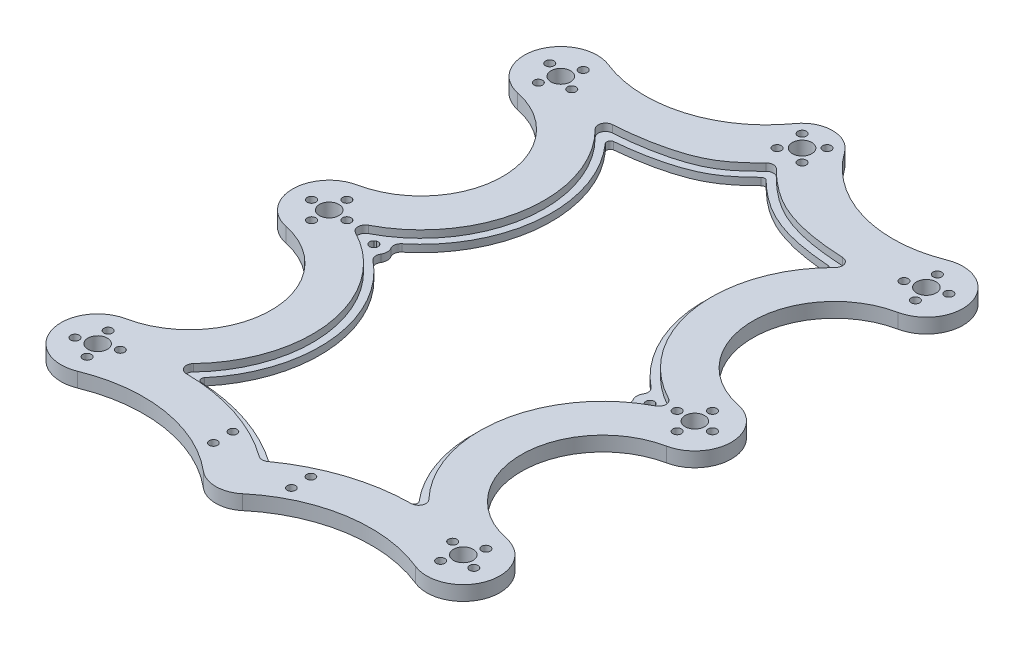
from build123d import *

# Parameters (mm, degrees)
BOSS_EXTRUDE1_DEPTH = 6
SKETCH2_R           = 4
CUT_EXTRUDE1_DEPTH  = 235.538376391
CUT_EXTRUDE2_REACH  = 236.538
SKETCH3_R           = 1.7
SKETCH4_R           = 3
CUT_EXTRUDE3_DEPTH  = 3
CUT_EXTRUDE4_REACH  = 236.481
CUT_EXTRUDE5_REACH  = 236.538
SKETCH6_R           = 1.75
CUT_EXTRUDE6_REACH  = 236.538
SKETCH8_R           = 1.75
BOSS_EXTRUDE2_START = -3.014
SKETCH9_R           = 4
SKETCH9_R_2         = 1.75
BOSS_EXTRUDE2_DEPTH = 3.014
FILLET1_R           = 3


with BuildPart() as part:
    # Sketch1 → Boss-Extrude1 (new body)
    with BuildSketch(Plane(origin=(0, 0, 0), x_dir=(1, 0, 0), z_dir=(0, 1, 0))):
        with BuildLine():
            ThreePointArc((-69.425886336, 13.925848515), (-89.364705834, 4.31916963), (-78.030296498, -14.690721668))
            ThreePointArc((-78.030296498, -14.690721668), (-51.297958971, -47.499999875), (-78.030296252, -80.309278281))
            ThreePointArc((-78.030296252, -80.309278281), (-90, -94.999999814), (-78.030296616, -109.690721644))
            ThreePointArc((-78.030296616, -109.690721644), (-51.297958971, -142.5), (-78.030296616, -175.309278356))
            ThreePointArc((-78.030296616, -175.309278356), (-89.351304792, -194.363490663), (-69.340019232, -203.891170494))
            ThreePointArc((-69.340019232, -203.891170494), (-37.34886135, -200.189043247), (-8.051740928, -213.561352835))
            ThreePointArc((-8.051740928, -213.561352835), (-6.73e-07, -216.5), (8.051739898, -213.561353702))
            ThreePointArc((8.051739898, -213.561353702), (37.348860289, -200.189043415), (69.340018489, -203.891170192))
            ThreePointArc((69.340018489, -203.891170192), (89.351304588, -194.363491335), (78.030297206, -175.309278478))
            ThreePointArc((78.030297206, -175.309278478), (51.297958971, -142.500000301), (78.030296616, -109.690721644))
            ThreePointArc((78.030296616, -109.690721644), (90, -95.000000257), (78.03029712, -80.30927846))
            ThreePointArc((78.03029712, -80.30927846), (51.297958971, -47.500000257), (78.030296616, -14.690721644))
            ThreePointArc((78.030296616, -14.690721644), (89.364705852, 4.319169572), (69.425886562, 13.925848605))
            ThreePointArc((69.425886562, 13.925848605), (36.800743446, 12.358424364), (10.169102241, 31.26906869))
            ThreePointArc((10.169102241, 31.26906869), (2.26e-07, 36.5), (-10.169101978, 31.269069058))
            ThreePointArc((-10.169101978, 31.269069058), (-36.800743112, 12.358424462), (-69.425886336, 13.925848515))
        make_face()
    extrude(amount=BOSS_EXTRUDE1_DEPTH)

    # Sketch2 → Cut-Extrude1 (cut, through all)
    with BuildSketch(Plane.XZ):
        with Locations(Location((-75, 190, 0), (0, 0, 270))):
            Circle(SKETCH2_R)
        with Locations(Location((-75, 95, 0), (0, 0, 270))):
            Circle(SKETCH2_R)
        with Locations(Location((-75, 0, 0), (0, 0, 270))):
            Circle(SKETCH2_R)
        with Locations(Location((75, 0, 0), (0, 0, 270))):
            Circle(SKETCH2_R)
        with Locations(Location((75, 95, 0), (0, 0, 270))):
            Circle(SKETCH2_R)
        with Locations(Location((75, 190, 0), (0, 0, 270))):
            Circle(SKETCH2_R)
        with Locations(Location((0, -24, 0), (0, 0, 270))):
            Circle(SKETCH2_R)
    extrude(amount=-CUT_EXTRUDE1_DEPTH, mode=Mode.SUBTRACT)

    # Sketch3 → Cut-Extrude2 (cut, up to next)
    with BuildSketch(Plane(origin=(0, 6, 0), x_dir=(1, 0, 0), z_dir=(0, 1, 0)), mode=Mode.PRIVATE) as cut_extrude2_sk1:
        with Locations(Location((-16, -193.5, 0), (0, 0, 270))):
            Circle(SKETCH3_R)
    cut_extrude2_tool1 = extrude(cut_extrude2_sk1.sketch, amount=-CUT_EXTRUDE2_REACH, mode=Mode.PRIVATE) & part.part
    # Sketch3 → Cut-Extrude2 (cut, up to next)
    with BuildSketch(Plane(origin=(0, 6, 0), x_dir=(1, 0, 0), z_dir=(0, 1, 0)), mode=Mode.PRIVATE) as cut_extrude2_sk2:
        with Locations(Location((16, -193.5, 0), (0, 0, 270))):
            Circle(SKETCH3_R)
    cut_extrude2_tool2 = extrude(cut_extrude2_sk2.sketch, amount=-CUT_EXTRUDE2_REACH, mode=Mode.PRIVATE) & part.part
    # Sketch3 → Cut-Extrude2 (cut, up to next)
    with BuildSketch(Plane(origin=(0, 6, 0), x_dir=(1, 0, 0), z_dir=(0, 1, 0)), mode=Mode.PRIVATE) as cut_extrude2_sk3:
        with Locations(Location((-16, -201.5, 0), (0, 0, 270))):
            Circle(SKETCH3_R)
    cut_extrude2_tool3 = extrude(cut_extrude2_sk3.sketch, amount=-CUT_EXTRUDE2_REACH, mode=Mode.PRIVATE) & part.part
    # Sketch3 → Cut-Extrude2 (cut, up to next)
    with BuildSketch(Plane(origin=(0, 6, 0), x_dir=(1, 0, 0), z_dir=(0, 1, 0)), mode=Mode.PRIVATE) as cut_extrude2_sk4:
        with Locations(Location((16, -201.5, 0), (0, 0, 270))):
            Circle(SKETCH3_R)
    cut_extrude2_tool4 = extrude(cut_extrude2_sk4.sketch, amount=-CUT_EXTRUDE2_REACH, mode=Mode.PRIVATE) & part.part
    add(cut_extrude2_tool1.solids().sort_by_distance((-16, 6, 193.5))[0], mode=Mode.SUBTRACT)
    add(cut_extrude2_tool2.solids().sort_by_distance((16, 6, 193.5))[0], mode=Mode.SUBTRACT)
    add(cut_extrude2_tool3.solids().sort_by_distance((-16, 6, 201.5))[0], mode=Mode.SUBTRACT)
    add(cut_extrude2_tool4.solids().sort_by_distance((16, 6, 201.5))[0], mode=Mode.SUBTRACT)

    # Sketch4 → Cut-Extrude3 (cut)
    with BuildSketch(Plane(origin=(0, 6, 0), x_dir=(1, 0, 0), z_dir=(0, 1, 0))):
        with BuildLine():
            ThreePointArc((2.13, 11.34626631), (2.773986301, 10.376027249), (3, 9.233661283))
            ThreePointArc((3, 9.233661283), (-1.142365966, 6.459674981), (-2.13, 11.34626631))
            add(Edge.make_bspline(
                [(-47.245546806, -6.557870933), (-40.951793168, -6.219213319), (-18.187442667, -3.598902949), (-6.815818988, 6.621864769), (-2.13, 11.34626631)],
                knots=[0, 0, 0, 0, 0.623295567, 1, 1, 1, 1], degree=3))
            ThreePointArc((-47.245546806, -6.557870933), (-49.887493948, -8.484702082), (-49.199135975, -11.681376335))
            ThreePointArc((-49.199135975, -11.681376335), (-34.880887667, -55.150881805), (-61.561288015, -92.336448598))
            ThreePointArc((-61.561288015, -92.336448598), (-63.180891721, -95), (-61.561288015, -97.663551402))
            ThreePointArc((-61.561288015, -97.663551402), (-34.984050038, -134.203948122), (-48.28431203, -177.385578497))
            ThreePointArc((-48.28431203, -177.385578497), (-48.877850173, -180.627466899), (-46.137118527, -182.457908916))
            ThreePointArc((-46.137118527, -182.457908916), (-22.820339988, -186.252316525), (-1.751253456, -196.937038477))
            ThreePointArc((-1.751253456, -196.937038477), (0, -197.501240593), (1.751253456, -196.937038477))
            ThreePointArc((1.751253456, -196.937038477), (22.820339988, -186.252316525), (46.137118527, -182.457908916))
            ThreePointArc((46.137118527, -182.457908916), (48.877850173, -180.627466899), (48.28431203, -177.385578497))
            ThreePointArc((48.28431203, -177.385578497), (34.984050038, -134.203948122), (61.561288015, -97.663551402))
            ThreePointArc((61.561288015, -97.663551402), (63.180891721, -95), (61.561288015, -92.336448598))
            ThreePointArc((61.561288015, -92.336448598), (34.880887667, -55.150881805), (49.199135975, -11.681376335))
            ThreePointArc((49.199135975, -11.681376335), (49.887493948, -8.484702082), (47.245546806, -6.557870933))
            add(Edge.make_bspline(
                [(47.245546806, -6.557870933), (36.441759728, -5.976535062), (19.515213818, -3.636843055), (6.858252431, 6.579081933), (2.13, 11.34626631)],
                knots=[0, 0, 0, 0, 0.623295567, 1, 1, 1, 1], degree=3))
        make_face()
        with Locations((0, 9.233661283)):
            Circle(SKETCH4_R)
    extrude(amount=-CUT_EXTRUDE3_DEPTH, mode=Mode.SUBTRACT)

    # Sketch5 → Cut-Extrude4 (cut, up to next)
    with BuildSketch(Plane(origin=(0, 3, 0), x_dir=(1, 0, 0), z_dir=(0, 1, 0)), mode=Mode.PRIVATE) as cut_extrude4_sk1:
        with BuildLine():
            ThreePointArc((1.052552176, 8.187899424), (-0.001191929, 8.615810534), (-1.052274419, 8.181402714))
            add(Edge.make_bspline(
                [(-1.052274419, 8.181402714), (-2.242286194, 7.002416459), (-3.450496942, 5.846704072), (-6.309975551, 3.302563541), (-7.987842757, 1.948152132), (-10.652863166, 0.106086551), (-11.565666108, -0.476650903), (-12.975360483, -1.298976249), (-13.451984812, -1.564482852), (-14.419053621, -2.077822072), (-14.910030293, -2.325849354), (-17.375943602, -3.510256231), (-19.401034298, -4.291254683), (-23.514506097, -5.651961387), (-25.603571212, -6.229494193), (-28.771479524, -6.986671088), (-29.833277502, -7.220526171), (-31.967170937, -7.655486003), (-33.039685289, -7.856626094), (-36.260168362, -8.413405962), (-38.414696203, -8.724122255), (-41.657016758, -9.105746696), (-42.739561635, -9.21874702), (-43.864941667, -9.319525105), (-43.905799567, -9.323162154), (-43.946660207, -9.326777221)],
                knots=[0.028545894, 0.028545894, 0.028545894, 0.028545894, 0.125, 0.125, 0.25, 0.25, 0.3125, 0.3125, 0.34375, 0.34375, 0.375, 0.375, 0.5, 0.5, 0.625, 0.625, 0.6875, 0.6875, 0.75, 0.75, 0.875, 0.875, 0.9375, 0.9375, 0.939854442, 0.939854442, 0.939854442, 0.939854442], degree=3))
            ThreePointArc((-43.946660207, -9.326777221), (-45.209534175, -10.269771733), (-44.932198535, -11.821278823))
            ThreePointArc((-44.932198535, -11.821278823), (-31.949329076, -55.822999349), (-57.827790649, -93.704545455))
            ThreePointArc((-57.827790649, -93.704545455), (-58.571617705, -95), (-57.827790649, -96.295454545))
            ThreePointArc((-57.827790649, -96.295454545), (-32.067735785, -133.457126412), (-43.974078795, -177.07832858))
            ThreePointArc((-43.974078795, -177.07832858), (-44.20500696, -178.646092501), (-42.90072221, -179.546121847))
            ThreePointArc((-42.90072221, -179.546121847), (-20.864438321, -183.742450502), (-0.859510899, -193.891827857))
            ThreePointArc((-0.859510899, -193.891827857), (0, -194.162502426), (0.859510899, -193.891827857))
            ThreePointArc((0.859510899, -193.891827857), (20.864438321, -183.742450502), (42.90072221, -179.546121847))
            ThreePointArc((42.90072221, -179.546121847), (44.20500696, -178.646092501), (43.974078795, -177.07832858))
            ThreePointArc((43.974078795, -177.07832858), (32.067735785, -133.457126412), (57.827790649, -96.295454545))
            ThreePointArc((57.827790649, -96.295454545), (58.571617705, -95), (57.827790649, -93.704545455))
            ThreePointArc((57.827790649, -93.704545455), (31.95236371, -55.842245591), (44.906221646, -11.850325482))
            ThreePointArc((44.906221646, -11.850325482), (45.17798059, -10.287515562), (43.895025167, -9.354641962))
            add(Edge.make_bspline(
                [(43.895025167, -9.354641962), (40.612147896, -9.119284285), (37.339576111, -8.782187164), (33.007463151, -8.103560897), (31.93394134, -7.915832543), (29.80407796, -7.498505539), (28.74650541, -7.268722095), (25.598678842, -6.507937043), (23.533241995, -5.90571282), (19.485072821, -4.463911303), (17.502296903, -3.624459109), (14.604633476, -2.145732758), (13.651517713, -1.616169578), (12.240445739, -0.768440013), (11.773368799, -0.477036616), (10.852264791, 0.118391325), (10.397309082, 0.422961504), (6.756207911, 2.941265149), (3.828410307, 5.47150922), (1.052552176, 8.187899424)],
                knots=[0.061111327, 0.061111327, 0.061111327, 0.061111327, 0.25, 0.25, 0.3125, 0.3125, 0.375, 0.375, 0.5, 0.5, 0.625, 0.625, 0.6875, 0.6875, 0.71875, 0.71875, 0.75, 0.75, 0.971778208, 0.971778208, 0.971778208, 0.971778208], degree=3))
        make_face()
    cut_extrude4_tool1 = extrude(cut_extrude4_sk1.sketch, amount=-CUT_EXTRUDE4_REACH, mode=Mode.PRIVATE) & part.part
    add(cut_extrude4_tool1.solids().sort_by_distance((-0.010538, 3, 93.854717))[0], mode=Mode.SUBTRACT)

    # Sketch6 → Cut-Extrude5 (cut, up to next)
    with BuildSketch(Plane(origin=(0, 6, 0), x_dir=(1, 0, 0), z_dir=(0, 1, 0)), mode=Mode.PRIVATE) as cut_extrude5_sk1:
        with Locations(Location((-68.189413426, -187.514359132, 0), (0, 0, 270))):
            Circle(SKETCH6_R)
    cut_extrude5_tool1 = extrude(cut_extrude5_sk1.sketch, amount=-CUT_EXTRUDE5_REACH, mode=Mode.PRIVATE) & part.part
    # Sketch6 → Cut-Extrude5 (cut, up to next)
    with BuildSketch(Plane(origin=(0, 6, 0), x_dir=(1, 0, 0), z_dir=(0, 1, 0)), mode=Mode.PRIVATE) as cut_extrude5_sk2:
        with Locations(Location((-72.514359132, -196.810586574, 0), (0, 0, 270))):
            Circle(SKETCH6_R)
    cut_extrude5_tool2 = extrude(cut_extrude5_sk2.sketch, amount=-CUT_EXTRUDE5_REACH, mode=Mode.PRIVATE) & part.part
    # Sketch6 → Cut-Extrude5 (cut, up to next)
    with BuildSketch(Plane(origin=(0, 6, 0), x_dir=(1, 0, 0), z_dir=(0, 1, 0)), mode=Mode.PRIVATE) as cut_extrude5_sk3:
        with Locations(Location((-81.810586574, -192.485640868, 0), (0, 0, 270))):
            Circle(SKETCH6_R)
    cut_extrude5_tool3 = extrude(cut_extrude5_sk3.sketch, amount=-CUT_EXTRUDE5_REACH, mode=Mode.PRIVATE) & part.part
    # Sketch6 → Cut-Extrude5 (cut, up to next)
    with BuildSketch(Plane(origin=(0, 6, 0), x_dir=(1, 0, 0), z_dir=(0, 1, 0)), mode=Mode.PRIVATE) as cut_extrude5_sk4:
        with Locations(Location((-77.485640868, -183.189413426, 0), (0, 0, 270))):
            Circle(SKETCH6_R)
    cut_extrude5_tool4 = extrude(cut_extrude5_sk4.sketch, amount=-CUT_EXTRUDE5_REACH, mode=Mode.PRIVATE) & part.part
    # Sketch6 → Cut-Extrude5 (cut, up to next)
    with BuildSketch(Plane(origin=(0, 6, 0), x_dir=(1, 0, 0), z_dir=(0, 1, 0)), mode=Mode.PRIVATE) as cut_extrude5_sk5:
        with Locations(Location((-75, -87.75, 0), (0, 0, 270))):
            Circle(SKETCH6_R)
    cut_extrude5_tool5 = extrude(cut_extrude5_sk5.sketch, amount=-CUT_EXTRUDE5_REACH, mode=Mode.PRIVATE) & part.part
    # Sketch6 → Cut-Extrude5 (cut, up to next)
    with BuildSketch(Plane(origin=(0, 6, 0), x_dir=(1, 0, 0), z_dir=(0, 1, 0)), mode=Mode.PRIVATE) as cut_extrude5_sk6:
        with Locations(Location((-67.75, -95, 0), (0, 0, 270))):
            Circle(SKETCH6_R)
    cut_extrude5_tool6 = extrude(cut_extrude5_sk6.sketch, amount=-CUT_EXTRUDE5_REACH, mode=Mode.PRIVATE) & part.part
    # Sketch6 → Cut-Extrude5 (cut, up to next)
    with BuildSketch(Plane(origin=(0, 6, 0), x_dir=(1, 0, 0), z_dir=(0, 1, 0)), mode=Mode.PRIVATE) as cut_extrude5_sk7:
        with Locations(Location((-75, -102.25, 0), (0, 0, 270))):
            Circle(SKETCH6_R)
    cut_extrude5_tool7 = extrude(cut_extrude5_sk7.sketch, amount=-CUT_EXTRUDE5_REACH, mode=Mode.PRIVATE) & part.part
    # Sketch6 → Cut-Extrude5 (cut, up to next)
    with BuildSketch(Plane(origin=(0, 6, 0), x_dir=(1, 0, 0), z_dir=(0, 1, 0)), mode=Mode.PRIVATE) as cut_extrude5_sk8:
        with Locations(Location((-82.25, -95, 0), (0, 0, 270))):
            Circle(SKETCH6_R)
    cut_extrude5_tool8 = extrude(cut_extrude5_sk8.sketch, amount=-CUT_EXTRUDE5_REACH, mode=Mode.PRIVATE) & part.part
    # Sketch6 → Cut-Extrude5 (cut, up to next)
    with BuildSketch(Plane(origin=(0, 6, 0), x_dir=(1, 0, 0), z_dir=(0, 1, 0)), mode=Mode.PRIVATE) as cut_extrude5_sk9:
        with Locations(Location((-68.140570631, -2.347494138, 0), (0, 0, 270))):
            Circle(SKETCH6_R)
    cut_extrude5_tool9 = extrude(cut_extrude5_sk9.sketch, amount=-CUT_EXTRUDE5_REACH, mode=Mode.PRIVATE) & part.part
    # Sketch6 → Cut-Extrude5 (cut, up to next)
    with BuildSketch(Plane(origin=(0, 6, 0), x_dir=(1, 0, 0), z_dir=(0, 1, 0)), mode=Mode.PRIVATE) as cut_extrude5_sk10:
        with Locations(Location((-77.347494138, -6.859429369, 0), (0, 0, 270))):
            Circle(SKETCH6_R)
    cut_extrude5_tool10 = extrude(cut_extrude5_sk10.sketch, amount=-CUT_EXTRUDE5_REACH, mode=Mode.PRIVATE) & part.part
    # Sketch6 → Cut-Extrude5 (cut, up to next)
    with BuildSketch(Plane(origin=(0, 6, 0), x_dir=(1, 0, 0), z_dir=(0, 1, 0)), mode=Mode.PRIVATE) as cut_extrude5_sk11:
        with Locations(Location((-81.859429369, 2.347494138, 0), (0, 0, 270))):
            Circle(SKETCH6_R)
    cut_extrude5_tool11 = extrude(cut_extrude5_sk11.sketch, amount=-CUT_EXTRUDE5_REACH, mode=Mode.PRIVATE) & part.part
    # Sketch6 → Cut-Extrude5 (cut, up to next)
    with BuildSketch(Plane(origin=(0, 6, 0), x_dir=(1, 0, 0), z_dir=(0, 1, 0)), mode=Mode.PRIVATE) as cut_extrude5_sk12:
        with Locations(Location((-72.652505862, 6.859429369, 0), (0, 0, 270))):
            Circle(SKETCH6_R)
    cut_extrude5_tool12 = extrude(cut_extrude5_sk12.sketch, amount=-CUT_EXTRUDE5_REACH, mode=Mode.PRIVATE) & part.part
    # Sketch6 → Cut-Extrude5 (cut, up to next)
    with BuildSketch(Plane(origin=(0, 6, 0), x_dir=(1, 0, 0), z_dir=(0, 1, 0)), mode=Mode.PRIVATE) as cut_extrude5_sk13:
        with Locations(Location((72.652505862, 6.859429369, 0), (0, 0, 270))):
            Circle(SKETCH6_R)
    cut_extrude5_tool13 = extrude(cut_extrude5_sk13.sketch, amount=-CUT_EXTRUDE5_REACH, mode=Mode.PRIVATE) & part.part
    # Sketch6 → Cut-Extrude5 (cut, up to next)
    with BuildSketch(Plane(origin=(0, 6, 0), x_dir=(1, 0, 0), z_dir=(0, 1, 0)), mode=Mode.PRIVATE) as cut_extrude5_sk14:
        with Locations(Location((81.859429369, 2.347494138, 0), (0, 0, 270))):
            Circle(SKETCH6_R)
    cut_extrude5_tool14 = extrude(cut_extrude5_sk14.sketch, amount=-CUT_EXTRUDE5_REACH, mode=Mode.PRIVATE) & part.part
    # Sketch6 → Cut-Extrude5 (cut, up to next)
    with BuildSketch(Plane(origin=(0, 6, 0), x_dir=(1, 0, 0), z_dir=(0, 1, 0)), mode=Mode.PRIVATE) as cut_extrude5_sk15:
        with Locations(Location((77.347494138, -6.859429369, 0), (0, 0, 270))):
            Circle(SKETCH6_R)
    cut_extrude5_tool15 = extrude(cut_extrude5_sk15.sketch, amount=-CUT_EXTRUDE5_REACH, mode=Mode.PRIVATE) & part.part
    # Sketch6 → Cut-Extrude5 (cut, up to next)
    with BuildSketch(Plane(origin=(0, 6, 0), x_dir=(1, 0, 0), z_dir=(0, 1, 0)), mode=Mode.PRIVATE) as cut_extrude5_sk16:
        with Locations(Location((68.140570631, -2.347494138, 0), (0, 0, 270))):
            Circle(SKETCH6_R)
    cut_extrude5_tool16 = extrude(cut_extrude5_sk16.sketch, amount=-CUT_EXTRUDE5_REACH, mode=Mode.PRIVATE) & part.part
    # Sketch6 → Cut-Extrude5 (cut, up to next)
    with BuildSketch(Plane(origin=(0, 6, 0), x_dir=(1, 0, 0), z_dir=(0, 1, 0)), mode=Mode.PRIVATE) as cut_extrude5_sk17:
        with Locations(Location((82.25, -95, 0), (0, 0, 270))):
            Circle(SKETCH6_R)
    cut_extrude5_tool17 = extrude(cut_extrude5_sk17.sketch, amount=-CUT_EXTRUDE5_REACH, mode=Mode.PRIVATE) & part.part
    # Sketch6 → Cut-Extrude5 (cut, up to next)
    with BuildSketch(Plane(origin=(0, 6, 0), x_dir=(1, 0, 0), z_dir=(0, 1, 0)), mode=Mode.PRIVATE) as cut_extrude5_sk18:
        with Locations(Location((75, -102.25, 0), (0, 0, 270))):
            Circle(SKETCH6_R)
    cut_extrude5_tool18 = extrude(cut_extrude5_sk18.sketch, amount=-CUT_EXTRUDE5_REACH, mode=Mode.PRIVATE) & part.part
    # Sketch6 → Cut-Extrude5 (cut, up to next)
    with BuildSketch(Plane(origin=(0, 6, 0), x_dir=(1, 0, 0), z_dir=(0, 1, 0)), mode=Mode.PRIVATE) as cut_extrude5_sk19:
        with Locations(Location((67.75, -95, 0), (0, 0, 270))):
            Circle(SKETCH6_R)
    cut_extrude5_tool19 = extrude(cut_extrude5_sk19.sketch, amount=-CUT_EXTRUDE5_REACH, mode=Mode.PRIVATE) & part.part
    # Sketch6 → Cut-Extrude5 (cut, up to next)
    with BuildSketch(Plane(origin=(0, 6, 0), x_dir=(1, 0, 0), z_dir=(0, 1, 0)), mode=Mode.PRIVATE) as cut_extrude5_sk20:
        with Locations(Location((75, -87.75, 0), (0, 0, 270))):
            Circle(SKETCH6_R)
    cut_extrude5_tool20 = extrude(cut_extrude5_sk20.sketch, amount=-CUT_EXTRUDE5_REACH, mode=Mode.PRIVATE) & part.part
    # Sketch6 → Cut-Extrude5 (cut, up to next)
    with BuildSketch(Plane(origin=(0, 6, 0), x_dir=(1, 0, 0), z_dir=(0, 1, 0)), mode=Mode.PRIVATE) as cut_extrude5_sk21:
        with Locations(Location((77.485640868, -183.189413426, 0), (0, 0, 270))):
            Circle(SKETCH6_R)
    cut_extrude5_tool21 = extrude(cut_extrude5_sk21.sketch, amount=-CUT_EXTRUDE5_REACH, mode=Mode.PRIVATE) & part.part
    # Sketch6 → Cut-Extrude5 (cut, up to next)
    with BuildSketch(Plane(origin=(0, 6, 0), x_dir=(1, 0, 0), z_dir=(0, 1, 0)), mode=Mode.PRIVATE) as cut_extrude5_sk22:
        with Locations(Location((81.810586574, -192.485640868, 0), (0, 0, 270))):
            Circle(SKETCH6_R)
    cut_extrude5_tool22 = extrude(cut_extrude5_sk22.sketch, amount=-CUT_EXTRUDE5_REACH, mode=Mode.PRIVATE) & part.part
    # Sketch6 → Cut-Extrude5 (cut, up to next)
    with BuildSketch(Plane(origin=(0, 6, 0), x_dir=(1, 0, 0), z_dir=(0, 1, 0)), mode=Mode.PRIVATE) as cut_extrude5_sk23:
        with Locations(Location((72.514359132, -196.810586574, 0), (0, 0, 270))):
            Circle(SKETCH6_R)
    cut_extrude5_tool23 = extrude(cut_extrude5_sk23.sketch, amount=-CUT_EXTRUDE5_REACH, mode=Mode.PRIVATE) & part.part
    # Sketch6 → Cut-Extrude5 (cut, up to next)
    with BuildSketch(Plane(origin=(0, 6, 0), x_dir=(1, 0, 0), z_dir=(0, 1, 0)), mode=Mode.PRIVATE) as cut_extrude5_sk24:
        with Locations(Location((68.189413426, -187.514359132, 0), (0, 0, 270))):
            Circle(SKETCH6_R)
    cut_extrude5_tool24 = extrude(cut_extrude5_sk24.sketch, amount=-CUT_EXTRUDE5_REACH, mode=Mode.PRIVATE) & part.part
    add(cut_extrude5_tool1.solids().sort_by_distance((-68.189413, 6, 187.514359))[0], mode=Mode.SUBTRACT)
    add(cut_extrude5_tool2.solids().sort_by_distance((-72.514359, 6, 196.810587))[0], mode=Mode.SUBTRACT)
    add(cut_extrude5_tool3.solids().sort_by_distance((-81.810587, 6, 192.485641))[0], mode=Mode.SUBTRACT)
    add(cut_extrude5_tool4.solids().sort_by_distance((-77.485641, 6, 183.189413))[0], mode=Mode.SUBTRACT)
    add(cut_extrude5_tool5.solids().sort_by_distance((-75, 6, 87.75))[0], mode=Mode.SUBTRACT)
    add(cut_extrude5_tool6.solids().sort_by_distance((-67.75, 6, 95))[0], mode=Mode.SUBTRACT)
    add(cut_extrude5_tool7.solids().sort_by_distance((-75, 6, 102.25))[0], mode=Mode.SUBTRACT)
    add(cut_extrude5_tool8.solids().sort_by_distance((-82.25, 6, 95))[0], mode=Mode.SUBTRACT)
    add(cut_extrude5_tool9.solids().sort_by_distance((-68.140571, 6, 2.347494))[0], mode=Mode.SUBTRACT)
    add(cut_extrude5_tool10.solids().sort_by_distance((-77.347494, 6, 6.859429))[0], mode=Mode.SUBTRACT)
    add(cut_extrude5_tool11.solids().sort_by_distance((-81.859429, 6, -2.347494))[0], mode=Mode.SUBTRACT)
    add(cut_extrude5_tool12.solids().sort_by_distance((-72.652506, 6, -6.859429))[0], mode=Mode.SUBTRACT)
    add(cut_extrude5_tool13.solids().sort_by_distance((72.652506, 6, -6.859429))[0], mode=Mode.SUBTRACT)
    add(cut_extrude5_tool14.solids().sort_by_distance((81.859429, 6, -2.347494))[0], mode=Mode.SUBTRACT)
    add(cut_extrude5_tool15.solids().sort_by_distance((77.347494, 6, 6.859429))[0], mode=Mode.SUBTRACT)
    add(cut_extrude5_tool16.solids().sort_by_distance((68.140571, 6, 2.347494))[0], mode=Mode.SUBTRACT)
    add(cut_extrude5_tool17.solids().sort_by_distance((82.25, 6, 95))[0], mode=Mode.SUBTRACT)
    add(cut_extrude5_tool18.solids().sort_by_distance((75, 6, 102.25))[0], mode=Mode.SUBTRACT)
    add(cut_extrude5_tool19.solids().sort_by_distance((67.75, 6, 95))[0], mode=Mode.SUBTRACT)
    add(cut_extrude5_tool20.solids().sort_by_distance((75, 6, 87.75))[0], mode=Mode.SUBTRACT)
    add(cut_extrude5_tool21.solids().sort_by_distance((77.485641, 6, 183.189413))[0], mode=Mode.SUBTRACT)
    add(cut_extrude5_tool22.solids().sort_by_distance((81.810587, 6, 192.485641))[0], mode=Mode.SUBTRACT)
    add(cut_extrude5_tool23.solids().sort_by_distance((72.514359, 6, 196.810587))[0], mode=Mode.SUBTRACT)
    add(cut_extrude5_tool24.solids().sort_by_distance((68.189413, 6, 187.514359))[0], mode=Mode.SUBTRACT)

    # Sketch8 → Cut-Extrude6 (cut, up to next)
    with BuildSketch(Plane(origin=(0, 6, 0), x_dir=(1, 0, 0), z_dir=(0, 1, 0)), mode=Mode.PRIVATE) as cut_extrude6_sk1:
        with Locations(Location((-5.126524164, 29.126524164, 0), (0, 0, 270))):
            Circle(SKETCH8_R)
    cut_extrude6_tool1 = extrude(cut_extrude6_sk1.sketch, amount=-CUT_EXTRUDE6_REACH, mode=Mode.PRIVATE) & part.part
    # Sketch8 → Cut-Extrude6 (cut, up to next)
    with BuildSketch(Plane(origin=(0, 6, 0), x_dir=(1, 0, 0), z_dir=(0, 1, 0)), mode=Mode.PRIVATE) as cut_extrude6_sk2:
        with Locations(Location((5.126524164, 29.126524164, 0), (0, 0, 270))):
            Circle(SKETCH8_R)
    cut_extrude6_tool2 = extrude(cut_extrude6_sk2.sketch, amount=-CUT_EXTRUDE6_REACH, mode=Mode.PRIVATE) & part.part
    # Sketch8 → Cut-Extrude6 (cut, up to next)
    with BuildSketch(Plane(origin=(0, 6, 0), x_dir=(1, 0, 0), z_dir=(0, 1, 0)), mode=Mode.PRIVATE) as cut_extrude6_sk3:
        with Locations(Location((5.126524164, 18.873475836, 0), (0, 0, 270))):
            Circle(SKETCH8_R)
    cut_extrude6_tool3 = extrude(cut_extrude6_sk3.sketch, amount=-CUT_EXTRUDE6_REACH, mode=Mode.PRIVATE) & part.part
    # Sketch8 → Cut-Extrude6 (cut, up to next)
    with BuildSketch(Plane(origin=(0, 6, 0), x_dir=(1, 0, 0), z_dir=(0, 1, 0)), mode=Mode.PRIVATE) as cut_extrude6_sk4:
        with Locations(Location((-5.126524164, 18.873475836, 0), (0, 0, 270))):
            Circle(SKETCH8_R)
    cut_extrude6_tool4 = extrude(cut_extrude6_sk4.sketch, amount=-CUT_EXTRUDE6_REACH, mode=Mode.PRIVATE) & part.part
    add(cut_extrude6_tool1.solids().sort_by_distance((-5.126524, 6, -29.126524))[0], mode=Mode.SUBTRACT)
    add(cut_extrude6_tool2.solids().sort_by_distance((5.126524, 6, -29.126524))[0], mode=Mode.SUBTRACT)
    add(cut_extrude6_tool3.solids().sort_by_distance((5.126524, 6, -18.873476))[0], mode=Mode.SUBTRACT)
    add(cut_extrude6_tool4.solids().sort_by_distance((-5.126524, 6, -18.873476))[0], mode=Mode.SUBTRACT)

    # Sketch9 → Boss-Extrude2 (add)
    # profile 1 of 2: a face of its own
    with BuildSketch(Plane(origin=(0, 3, 0), x_dir=(1, 0, 0), z_dir=(0, 1, 0)).offset(BOSS_EXTRUDE2_START)):
        with Locations(Location((-55.180891721, -95, 0), (0, 0, 270))):
            Circle(SKETCH9_R)
        with Locations(Location((-56.680891721, -95, 0), (0, 0, 270))):
            Circle(SKETCH9_R_2, mode=Mode.SUBTRACT)
    # profile 2 of 2: a face of its own
    with BuildSketch(Plane(origin=(0, 3, 0), x_dir=(1, 0, 0), z_dir=(0, 1, 0)).offset(BOSS_EXTRUDE2_START)):
        with Locations(Location((55.180891721, -95, 0), (0, 0, 270))):
            Circle(SKETCH9_R)
        with Locations(Location((56.680891721, -95, 0), (0, 0, 270))):
            Circle(SKETCH9_R_2, mode=Mode.SUBTRACT)
    extrude(amount=BOSS_EXTRUDE2_DEPTH)

    # Fillet1
    fillet1_edges = [part.edges().sort_by_distance(p)[0] for p in [
        (-53.933595907, 1.5, 91.199440416),
        (-53.933595907, 1.5, 98.800559584),
        (53.933595907, 1.5, 98.800559584),
        (53.933595907, 1.5, 91.199440416),
    ]]
    fillet(fillet1_edges, radius=FILLET1_R)


solid = part.part
